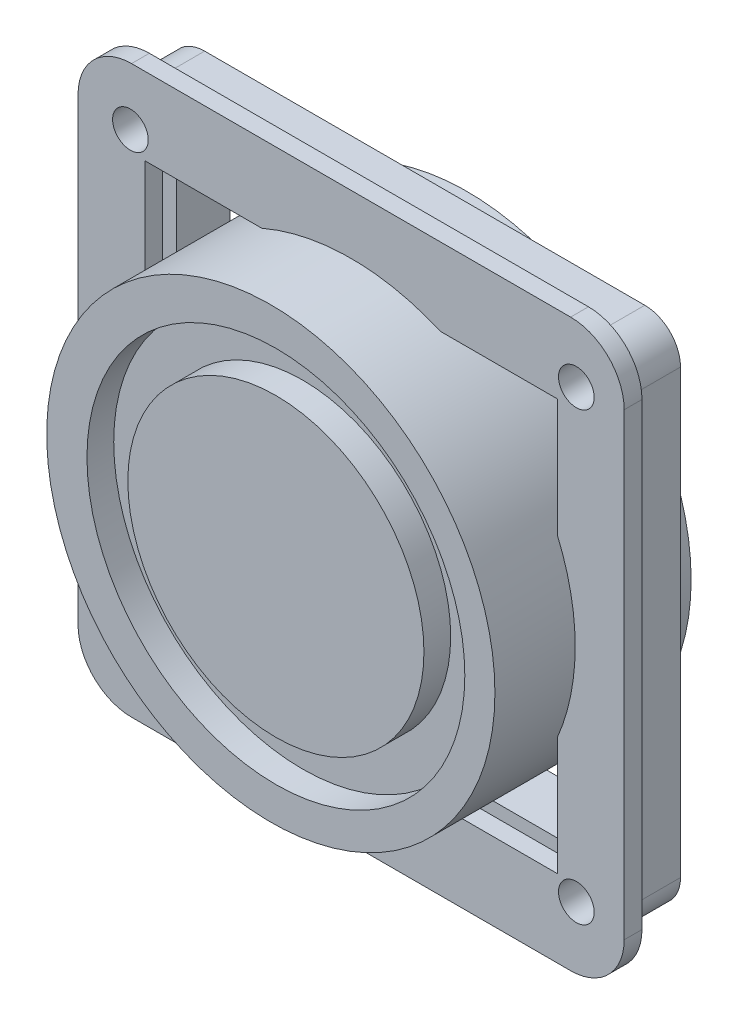
from build123d import *

# Parameters (mm, degrees)
SKETCH_1_W          = 28.676374442
SKETCH_1_H          = 28.786423303
SKETCH_1_R          = 1
SKETCH_1_W_2        = 21.847787884
SKETCH_1_H_2        = 21.847787883
EXTRUDE_1_DEPTH     = 3
FILLET_1_R          = 2
SKETCH_2_R          = 12.563691981
EXTRUDE_2_DEPTH     = 5.5
SKETCH_3_W          = 30.61596727
SKETCH_3_H          = 31.734673245
SKETCH_3_R          = 1
SKETCH_3_W_2        = 23.133890408
SKETCH_3_H_2        = 23.048584014
EXTRUDE_3_DEPTH     = 1
SKETCH_5_R          = 10.591689203
SKETCH_5_R_2        = 8.299790342
CUT_EXTRUDE_1_DEPTH = 1.5
FILLET_2_R          = 3


with BuildPart() as part:
    # 草图1 → 凸台-拉伸1 (new body)
    with BuildSketch(Plane.XY):
        with Locations((4.252772695, -4.754098361)):
            Rectangle(SKETCH_1_W, SKETCH_1_H)
        with Locations((-8.247227305, 7.745901639)):
            Circle(SKETCH_1_R, mode=Mode.SUBTRACT)
        with Locations((16.752772695, 7.745901639)):
            Circle(SKETCH_1_R, mode=Mode.SUBTRACT)
        with Locations((16.752772695, -17.254098361)):
            Circle(SKETCH_1_R, mode=Mode.SUBTRACT)
        with Locations((-8.247227305, -17.254098361)):
            Circle(SKETCH_1_R, mode=Mode.SUBTRACT)
        with Locations((4.252772695, -4.754098361)):
            Rectangle(SKETCH_1_W_2, SKETCH_1_H_2, mode=Mode.SUBTRACT)
    extrude(amount=EXTRUDE_1_DEPTH)

    # 圆角1
    fillet_1_edges = [part.edges().sort_by_distance(p)[0] for p in [
        (18.590959916, -19.147310012, 1.5),
        (-10.085414526, -19.147310012, 1.5),
        (-10.085414526, 9.639113291, 1.5),
        (18.590959916, 9.639113291, 1.5),
    ]]
    fillet(fillet_1_edges, radius=FILLET_1_R)

    # 草图2 → 凸台-拉伸2 (add, symmetric)
    with BuildSketch(Plane.XY.offset(3)):
        with Locations((4.123944992, -4.882926064)):
            Circle(SKETCH_2_R)
    extrude(amount=EXTRUDE_2_DEPTH, both=True)

    # 草图3 → 凸台-拉伸3 (add)
    with BuildSketch(Plane.XY.offset(3)):
        with Locations((4.123944992, -4.882926064)):
            Rectangle(SKETCH_3_W, SKETCH_3_H)
        with Locations((-8.247227305, 7.745901639)):
            Circle(SKETCH_3_R, mode=Mode.SUBTRACT)
        with Locations((-8.247227305, -17.254098361)):
            Circle(SKETCH_3_R, mode=Mode.SUBTRACT)
        with Locations((16.752772695, -17.254098361)):
            Circle(SKETCH_3_R, mode=Mode.SUBTRACT)
        with Locations((16.752772695, 7.745901639)):
            Circle(SKETCH_3_R, mode=Mode.SUBTRACT)
        with Locations((4.123944992, -4.882926064)):
            Rectangle(SKETCH_3_W_2, SKETCH_3_H_2, mode=Mode.SUBTRACT)
    extrude(amount=EXTRUDE_3_DEPTH)

    # 草图5 → 切除-拉伸1 (cut)
    with BuildSketch(Plane.XY.offset(8.5)):
        with Locations((4.408371776, -4.882926064)):
            Circle(SKETCH_5_R)
        with Locations((4.408371776, -4.882926064)):
            Circle(SKETCH_5_R_2, mode=Mode.SUBTRACT)
    extrude(amount=-CUT_EXTRUDE_1_DEPTH, mode=Mode.SUBTRACT)

    # 圆角2
    fillet_2_edges = [part.edges().sort_by_distance(p)[0] for p in [
        (19.431928627, -20.750262686, 3.5),
        (19.431928627, 10.984410559, 3.5),
        (-11.184038643, 10.984410559, 3.5),
        (-11.184038643, -20.750262686, 3.5),
    ]]
    fillet(fillet_2_edges, radius=FILLET_2_R)


solid = part.part
